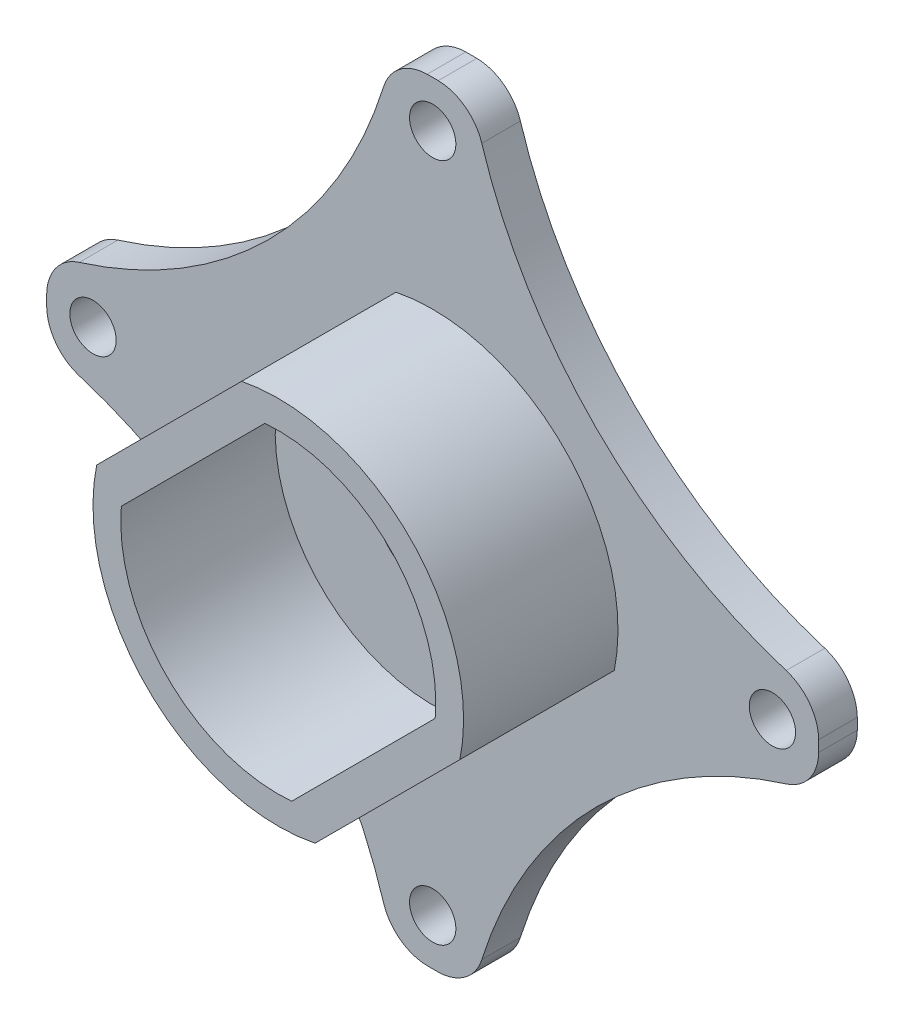
from build123d import *

# Parameters (mm, degrees)
SKETCH_1_R               = 25
SKETCH_1_R_2             = 1.5
EXTRUDE_1_DEPTH          = 2.5
CUT_EXTRUDE_2_DEPTH      = 36.443617197
CUT_EXTRUDE_2_DEPTH_BACK = 36.443617197
SKETCH_3_R               = 4
CUT_EXTRUDE_5_DEPTH      = 10
FILLET_2_R               = 3
EXTRUDE_2_DEPTH          = 10


with BuildPart() as part:
    # 草图1 → 凸台-拉伸1 (new body)
    with BuildSketch(Plane.XY):
        Circle(SKETCH_1_R)
        with Locations((0, 22)):
            Circle(SKETCH_1_R_2, mode=Mode.SUBTRACT)
        with Locations((22, 0)):
            Circle(SKETCH_1_R_2, mode=Mode.SUBTRACT)
        with Locations((0, -22)):
            Circle(SKETCH_1_R_2, mode=Mode.SUBTRACT)
        with Locations(Location((-22, 0, 0), (0, 0, 180))):
            Circle(SKETCH_1_R_2, mode=Mode.SUBTRACT)
    extrude(amount=EXTRUDE_1_DEPTH)

    # 草图3 → 切除-拉伸2 (cut, two sides: drawn at the far end of the back side and taken through both)
    with BuildSketch(Plane(origin=(0, 0, 0), x_dir=(-1, 0, 0), z_dir=(0, 0, -1)).offset(-CUT_EXTRUDE_2_DEPTH_BACK)):
        Circle(SKETCH_3_R)
    extrude(amount=CUT_EXTRUDE_2_DEPTH + CUT_EXTRUDE_2_DEPTH_BACK, mode=Mode.SUBTRACT)

    # 草图5 → 切除-拉伸5 (cut)
    with BuildSketch(Plane(origin=(0, 0, 0), x_dir=(-1, 0, 0), z_dir=(0, 0, -1))):
        with BuildLine():
            ThreePointArc((-2.638187412, 24.860409634), (-17.67766953, 17.67766953), (-24.860409634, 2.638187412))
            ThreePointArc((-24.860409634, 2.638187412), (-10.606601718, 10.606601718), (-2.638187412, 24.860409634))
        make_face()
        with BuildLine():
            ThreePointArc((-2.638187412, -24.860409634), (-10.606601718, -10.606601718), (-24.860409634, -2.638187412))
            ThreePointArc((-24.860409634, -2.638187412), (-17.67766953, -17.67766953), (-2.638187412, -24.860409634))
        make_face()
        with BuildLine():
            ThreePointArc((24.860409634, -2.638187412), (10.606601718, -10.606601718), (2.638187412, -24.860409634))
            ThreePointArc((2.638187412, -24.860409634), (17.67766953, -17.67766953), (24.860409634, -2.638187412))
        make_face()
        with BuildLine():
            ThreePointArc((24.860409634, 2.638187412), (17.67766953, 17.67766953), (2.638187412, 24.860409634))
            ThreePointArc((2.638187412, 24.860409634), (10.606601718, 10.606601718), (24.860409634, 2.638187412))
        make_face()
    extrude(amount=-CUT_EXTRUDE_5_DEPTH, mode=Mode.SUBTRACT)

    # 圆角2
    fillet_2_edges = [part.edges().sort_by_distance(p)[0] for p in [
        (2.638187412, 24.860409634, 1.25),
        (24.860409634, 2.638187412, 1.25),
        (24.860409634, -2.638187412, 1.25),
        (2.638187412, -24.860409634, 1.25),
        (-2.638187412, -24.860409634, 1.25),
        (-24.860409634, -2.638187412, 1.25),
        (-24.860409634, 2.638187412, 1.25),
        (-2.638187412, 24.860409634, 1.25),
    ]]
    fillet(fillet_2_edges, radius=FILLET_2_R)

    # 草图6 → 凸台-拉伸2 (add)
    with BuildSketch(Plane.XY.offset(2.5)):
        with BuildLine():
            Line((-11.761483572, 2.380652052), (-2.380652052, 11.761483572))
            ThreePointArc((-2.380652052, 11.761483572), (8.485281374, 8.485281374), (11.761483572, -2.380652052))
            Line((11.761483572, -2.380652052), (2.380652052, -11.761483572))
            ThreePointArc((2.380652052, -11.761483572), (-8.485281374, -8.485281374), (-11.761483572, 2.380652052))
        make_face()
        with BuildLine():
            Line((-10.163012909, 0.867852878), (-0.867852878, 10.163012909))
            ThreePointArc((-0.867852878, 10.163012909), (7.212489168, 7.212489168), (10.163012909, -0.867852878))
            Line((10.163012909, -0.867852878), (0.867852878, -10.163012909))
            ThreePointArc((0.867852878, -10.163012909), (-7.212489168, -7.212489168), (-10.163012909, 0.867852878))
        make_face(mode=Mode.SUBTRACT)
    extrude(amount=EXTRUDE_2_DEPTH)


solid = part.part
